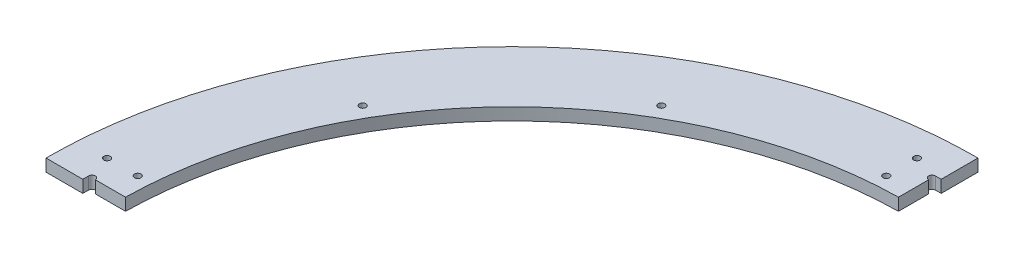
from build123d import *

# Parameters (mm, degrees)
BOSS_EXTRUDE1_DEPTH     = 12.7
SKETCH2_W               = 12.7
SKETCH2_H               = 38.149612403
SKETCH2_W_2             = 38.149612403
SKETCH2_H_2             = 12.7
CUT_EXTRUDE1_DEPTH      = 683.617616239
SKETCH3_R               = 3.429
CUT_EXTRUDE2_DEPTH      = 683.617616239
F_1_4_CLEARANCE_HOLE1_D = 6.7564
SKETCH8_W               = 482.6
SKETCH8_H               = 482.6
CUT_EXTRUDE4_DEPTH      = 683.617616239
SKETCH9_W               = 0.3175
SKETCH9_H               = 38.1
SKETCH9_W_2             = 38.1
SKETCH9_H_2             = 0.3175
CUT_EXTRUDE5_DEPTH      = 683.617616239


with BuildPart() as part:
    # Sketch1 → Boss-Extrude1 (new body)
    with BuildSketch(Plane(origin=(0, 0, 0), x_dir=(1, 0, 0), z_dir=(0, 1, 0))):
        with BuildLine():
            Line((-406.4, 0), (-482.6, 0))
            ThreePointArc((-482.6, 0), (0, 482.6), (482.6, 0))
            Line((482.6, 0), (406.4, 0))
            ThreePointArc((406.4, 0), (0, 406.4), (-406.4, 0))
        make_face()
    extrude(amount=BOSS_EXTRUDE1_DEPTH)

    # Sketch2 → Cut-Extrude1 (cut, through all)
    with BuildSketch(Plane(origin=(0, 12.7, 0), x_dir=(1, 0, 0), z_dir=(0, 1, 0))):
        with Locations((0, 425.425193799)):
            Rectangle(SKETCH2_W, SKETCH2_H)
        with Locations((425.425193799, 0)):
            Rectangle(SKETCH2_W_2, SKETCH2_H_2)
        with Locations((0, -425.425193799)):
            Rectangle(SKETCH2_W, SKETCH2_H)
        with Locations((-425.425193799, 0)):
            Rectangle(SKETCH2_W_2, SKETCH2_H_2)
    extrude(amount=-CUT_EXTRUDE1_DEPTH, mode=Mode.SUBTRACT)

    # Sketch3 → Cut-Extrude2 (cut, through all)
    with BuildSketch(Plane(origin=(0, 12.7, 0), x_dir=(1, 0, 0), z_dir=(0, 1, 0))):
        with Locations((-6.35, 441.071)):
            Circle(SKETCH3_R)
        with Locations((-441.071, 6.35)):
            Circle(SKETCH3_R)
        with Locations((6.35, 441.071)):
            Circle(SKETCH3_R)
        with Locations((441.071, 6.35)):
            Circle(SKETCH3_R)
    extrude(amount=-CUT_EXTRUDE2_DEPTH, mode=Mode.SUBTRACT)

    # 1/4 Clearance Hole1 (through all)
    with Locations(Plane(origin=(0, 12.7, 0), x_dir=(1, 0, 0), z_dir=(0, 1, 0))):
        with Locations((-365.700877383, 211.1375), (-31.75, 419.1), (-31.75, 450.85), (-419.1, 31.75), (-450.85, 31.75), (-211.1375, 365.700877383)):
            Hole(F_1_4_CLEARANCE_HOLE1_D / 2)

    # Sketch8 → Cut-Extrude4 (cut, through all)
    with BuildSketch(Plane(origin=(0, 12.7, 0), x_dir=(1, 0, 0), z_dir=(0, 1, 0))):
        with Locations((241.3, 241.3)):
            Rectangle(SKETCH8_W, SKETCH8_H)
    extrude(amount=-CUT_EXTRUDE4_DEPTH, mode=Mode.SUBTRACT)

    # Sketch9 → Cut-Extrude5 (cut, through all)
    with BuildSketch(Plane(origin=(0, 12.7, 0), x_dir=(1, 0, 0), z_dir=(0, 1, 0))):
        with Locations((-0.15875, 463.55)):
            Rectangle(SKETCH9_W, SKETCH9_H)
        with Locations((-463.55, 0.15875)):
            Rectangle(SKETCH9_W_2, SKETCH9_H_2)
    extrude(amount=-CUT_EXTRUDE5_DEPTH, mode=Mode.SUBTRACT)


solid = part.part
